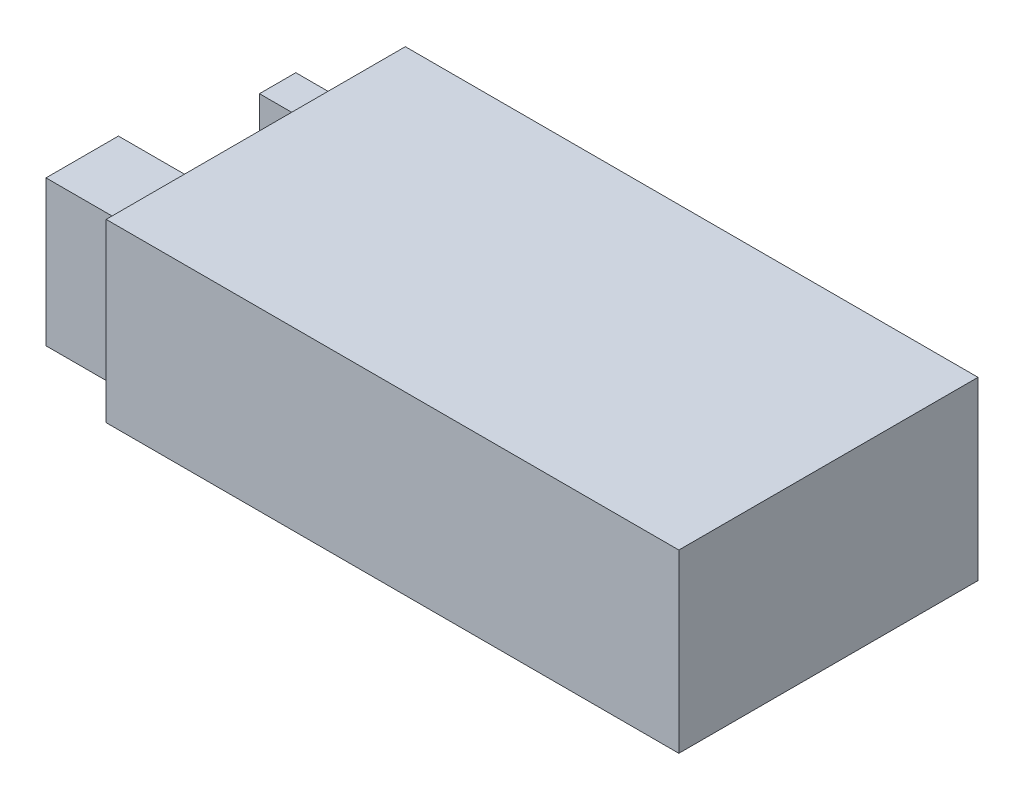
from build123d import *

# Parameters (mm, degrees)
SKETCH1_W           = 67
SKETCH1_H           = 35
BOSS_EXTRUDE1_DEPTH = 20.6
SKETCH2_W           = 4.254648544
SKETCH2_H           = 10.285150392
SKETCH2_W_2         = 8.472300143
SKETCH2_H_2         = 17.018594174
BOSS_EXTRUDE2_DEPTH = 10


with BuildPart() as part:
    # Sketch1 → Boss-Extrude1 (new body)
    with BuildSketch(Plane(origin=(0, 0, 0), x_dir=(1, 0, 0), z_dir=(0, 1, 0))):
        Rectangle(SKETCH1_W, SKETCH1_H)
    extrude(amount=BOSS_EXTRUDE1_DEPTH)

    # Sketch2 → Boss-Extrude2 (add)
    with BuildSketch(Plane.ZY.offset(33.5)):
        with Locations((-12.560462439, 9.227088628)):
            Rectangle(SKETCH2_W, SKETCH2_H)
        with Locations((10.303648864, 9.81903973)):
            Rectangle(SKETCH2_W_2, SKETCH2_H_2)
    extrude(amount=BOSS_EXTRUDE2_DEPTH)


solid = part.part
